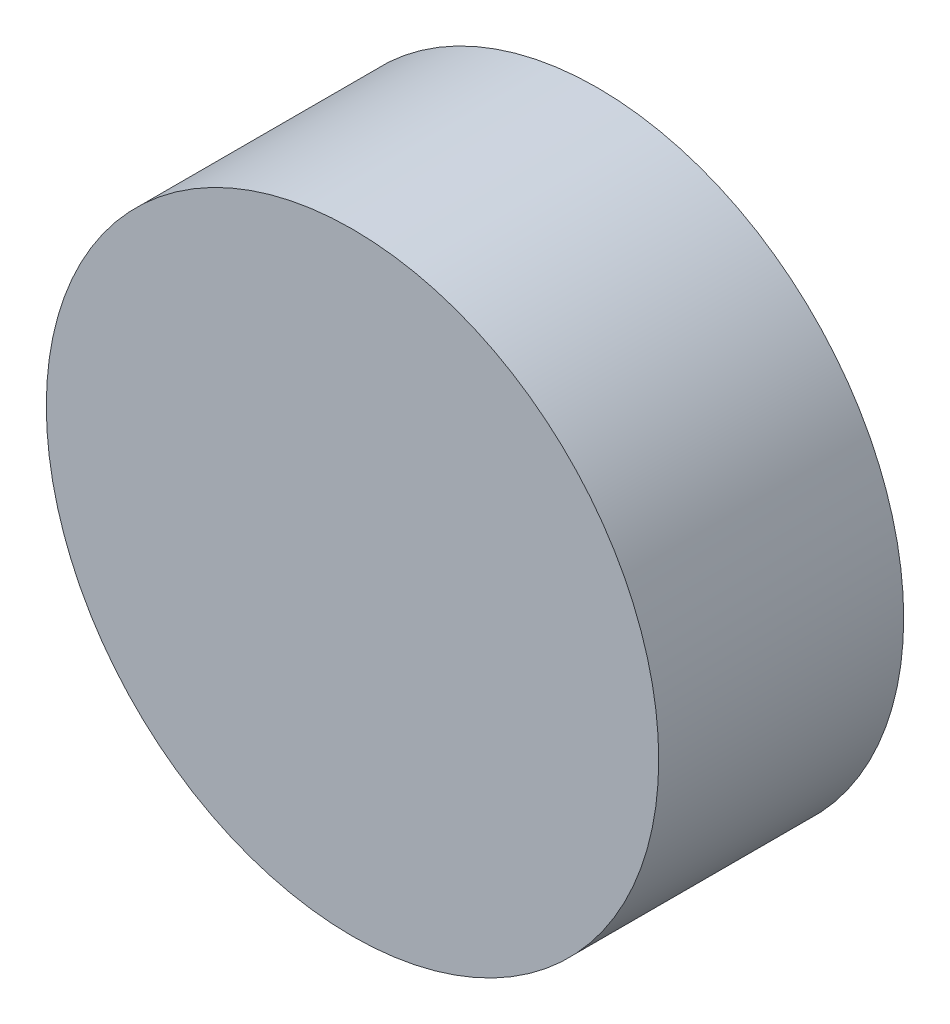
from build123d import *

# Parameters (mm, degrees)
SKETCH_1_W            = 10
SKETCH_1_H            = 8
CUT_EXTRUDE_928_DEPTH = 6
CHAMFER_1_SIZE        = 1


with BuildPart() as part:
    # Эскиз1 → Повернуть1 (revolve)
    with BuildSketch(Plane(origin=(0, 0, 0), x_dir=(1, 0, 0), z_dir=(0, 1, 0))):
        with Locations((-5, -4)):
            Rectangle(SKETCH_1_W, SKETCH_1_H)
    revolve(axis=Axis((0, 0, 10.353242845), (0, 0, -1)))

    # Эскиз2 → Cut-Extrude 928 (cut)
    with BuildSketch(Plane(origin=(0, 0, 0), x_dir=(-1, 0, 0), z_dir=(0, 0, -1))):
        with BuildLine():
            Line((1.2489996, -1), (-1.2489996, -1))
            ThreePointArc((-1.2489996, -1), (0, 1.6), (1.2489996, -1))
        make_face()
    extrude(amount=-CUT_EXTRUDE_928_DEPTH, mode=Mode.SUBTRACT)

    # Фаска1
    chamfer_1_edges = [part.edges().sort_by_distance(p)[0] for p in [
        (0, 1.6, 0),
        (0, -1, 0),
    ]]
    chamfer(chamfer_1_edges, length=CHAMFER_1_SIZE)


solid = part.part
